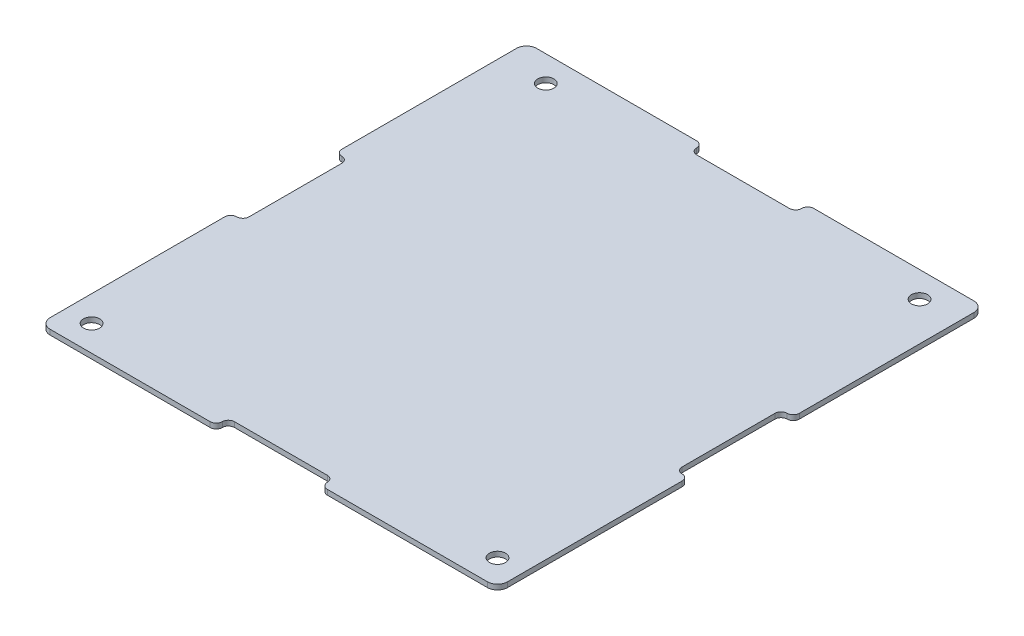
from build123d import *

# Parameters (mm, degrees)
SKETCH_1_R      = 1.59
EXTRUDE_1_DEPTH = 1


with BuildPart() as part:
    # Эскиз1 → Бобышка-Вытянуть1 (new body)
    with BuildSketch(Plane(origin=(0, 0, 0), x_dir=(1, 0, 0), z_dir=(0, 1, 0))):
        with BuildLine():
            Line((-45.084998549, -11.549999236), (-45.084998549, -45.944999694))
            ThreePointArc((-45.084998549, -45.944999694), (-44.499026016, -47.35966253), (-43.084363181, -47.945635063))
            Line((-43.084363181, -47.945635063), (-11.549432233, -47.945635063))
            ThreePointArc((-11.549432233, -47.945635063), (-10.700904348, -47.594163453), (-10.349432233, -46.745635778))
            ThreePointArc((-10.349432233, -46.745635778), (-9.997959671, -45.897107024), (-9.149430707, -45.545634967))
            Line((-9.149430707, -45.545634967), (9.15056853, -45.545634967))
            ThreePointArc((9.15056853, -45.545634967), (9.999097494, -45.897107024), (10.350570056, -46.745635778))
            ThreePointArc((10.350570056, -46.745635778), (10.702042171, -47.594163453), (11.550570056, -47.945635063))
            Line((11.550570056, -47.945635063), (43.085566089, -47.945635063))
            ThreePointArc((43.085566089, -47.945635063), (44.499379352, -47.360014435), (45.08499998, -45.946201172))
            Line((45.08499998, -45.946201172), (45.08499998, -11.550001001))
            ThreePointArc((45.08499998, -11.550001001), (44.73352809, -10.70147331), (43.885000099, -10.350002145))
            ThreePointArc((43.885000099, -10.350002145), (43.03647086, -9.998530464), (42.684998454, -9.150001525))
            Line((42.684998454, -9.150001525), (42.684998454, 9.150001525))
            ThreePointArc((42.684998454, 9.150001525), (43.03647086, 9.998530464), (43.885000099, 10.350002145))
            ThreePointArc((43.885000099, 10.350002145), (44.733527178, 10.701472863), (45.08499962, 11.549999228))
            Line((45.08499962, 11.549999228), (45.08499962, 45.944999694))
            ThreePointArc((45.08499962, 45.944999694), (44.499213182, 47.359213257), (43.08499962, 47.944999694))
            Line((43.08499962, 47.944999694), (11.549999772, 47.944999694))
            ThreePointArc((11.549999772, 47.944999694), (10.701471635, 47.593527832), (10.349999772, 46.744999694))
            ThreePointArc((10.349999772, 46.744999694), (9.998527463, 45.896470478), (9.149998246, 45.544998168))
            Line((9.149998246, 45.544998168), (-9.149997176, 45.544998168))
            ThreePointArc((-9.149997176, 45.544998168), (-9.998526392, 45.896470478), (-10.349998702, 46.744999694))
            ThreePointArc((-10.349998702, 46.744999694), (-10.701470564, 47.593527832), (-11.549998702, 47.944999694))
            Line((-11.549998702, 47.944999694), (-43.084998549, 47.944999694))
            ThreePointArc((-43.084998549, 47.944999694), (-44.499212112, 47.359213257), (-45.084998549, 45.944999694))
            Line((-45.084998549, 45.944999694), (-45.084998549, 11.549999236))
            ThreePointArc((-45.084998549, 11.549999236), (-44.733526654, 10.701471175), (-43.884998501, 10.349999499))
            ThreePointArc((-43.884998501, 10.349999499), (-43.036470349, 9.998527823), (-42.684998454, 9.149999761))
            Line((-42.684998454, 9.149999761), (-42.684998454, -9.149999761))
            ThreePointArc((-42.684998454, -9.149999761), (-43.036470608, -9.998528446), (-43.884999384, -10.350000381))
            ThreePointArc((-43.884999384, -10.350000381), (-44.733526912, -10.701471799), (-45.084998549, -11.549999236))
        make_face()
        with Locations(Location((37.465001451, 42.865000306, 0), (0, 0, 270))):
            Circle(SKETCH_1_R, mode=Mode.SUBTRACT)
        with Locations(Location((40.005001451, -42.864999694, 0), (0, 0, 270))):
            Circle(SKETCH_1_R, mode=Mode.SUBTRACT)
        with Locations(Location((-40.004998549, -42.864999694, 0), (0, 0, 270))):
            Circle(SKETCH_1_R, mode=Mode.SUBTRACT)
        with Locations(Location((-36.194998549, 42.865000306, 0), (0, 0, 270))):
            Circle(SKETCH_1_R, mode=Mode.SUBTRACT)
    extrude(amount=EXTRUDE_1_DEPTH)


solid = part.part
